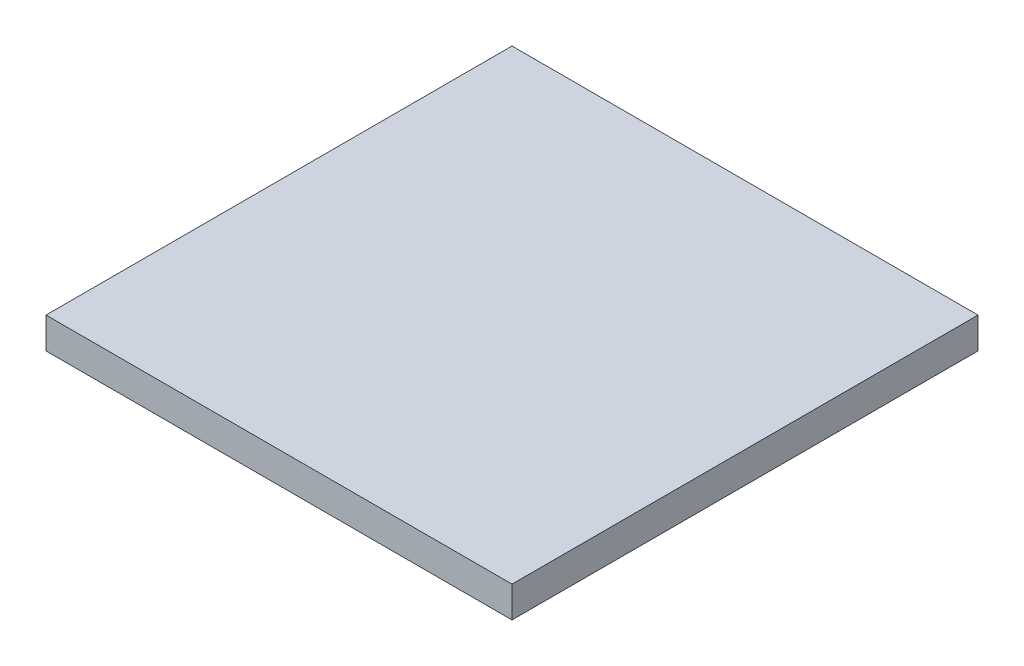
from build123d import *

# Parameters (mm, degrees)
SKETCH1_W           = 15
SKETCH1_H           = 15
BOSS_EXTRUDE1_DEPTH = 1


with BuildPart() as part:
    # Sketch1 → Boss-Extrude1 (new body)
    with BuildSketch(Plane(origin=(0, 0, 0), x_dir=(1, 0, 0), z_dir=(0, 1, 0))):
        with Locations((7.5, 7.5)):
            Rectangle(SKETCH1_W, SKETCH1_H)
    extrude(amount=BOSS_EXTRUDE1_DEPTH)


solid = part.part
